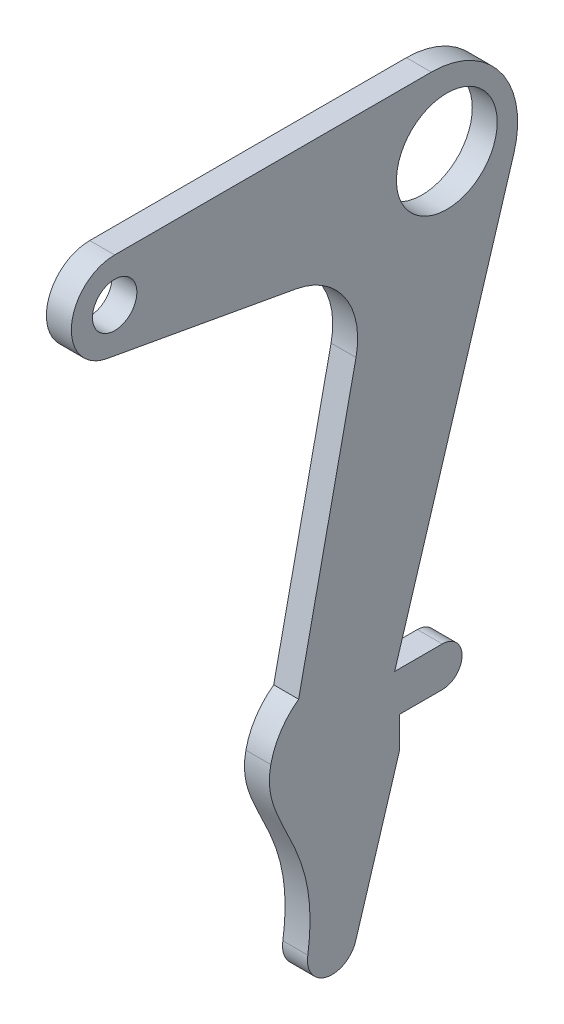
from build123d import *

# Parameters (mm, degrees)
SKETCH1_R           = 5.1308
SKETCH1_R_2         = 2.262010882
BOSS_EXTRUDE1_DEPTH = 2.54


with BuildPart() as part:
    # Sketch1 → Boss-Extrude1 (new body)
    with BuildSketch(Plane(origin=(0, 0, 0), x_dir=(0, 0, -1), z_dir=(1, 0, 0))):
        with BuildLine():
            Line((-32.256192364, 8.796557636), (0, 8.796557636))
            ThreePointArc((0, 8.796557636), (7.072772121, 5.230231425), (8.410616185, -2.577006332))
            Line((8.410616185, -2.577006332), (-3.731873822, -42.206642364))
            Line((-3.731873822, -42.206642364), (1.115138458, -42.206642364))
            ThreePointArc((1.115138458, -42.206642364), (3.134438458, -44.225942364), (1.115138458, -46.245242364))
            Line((1.115138458, -46.245242364), (-3.266361542, -46.245242364))
            Line((-3.266361542, -46.245242364), (-3.266361542, -49.521842364))
            Line((-3.266361542, -49.521842364), (-7.701250082, -63.996057998))
            ThreePointArc((-7.701250082, -63.996057998), (-10.694320166, -65.70408502), (-12.581554006, -62.820654204))
            add(Edge.make_bspline(
                [(-16.349353221, -44.121567363), (-17.528227781, -49.64987319), (-11.082221769, -52.675290574), (-12.581554006, -62.820654204)],
                knots=[0, 0, 0, 0, 1, 1, 1, 1], degree=3))
            ThreePointArc((-16.349353221, -44.121567363), (-15.336629179, -41.682166261), (-13.516414071, -39.768242364))
            Line((-13.516414071, -39.768242364), (-7.67265893, -12.543758648))
            ThreePointArc((-7.67265893, -12.543758648), (-8.792024721, -6.703826274), (-13.766553539, -3.446242364))
            Line((-13.766553539, -3.446242364), (-33.041775294, 0.040539507))
            ThreePointArc((-33.041775294, 0.040539507), (-36.651786579, 4.777676826), (-32.256192364, 8.796557636))
        make_face()
        with Locations((1.580189797, 1.024157636)):
            Circle(SKETCH1_R, mode=Mode.SUBTRACT)
        with Locations((-32.256192364, 4.383307636)):
            Circle(SKETCH1_R_2, mode=Mode.SUBTRACT)
    extrude(amount=BOSS_EXTRUDE1_DEPTH)


solid = part.part
